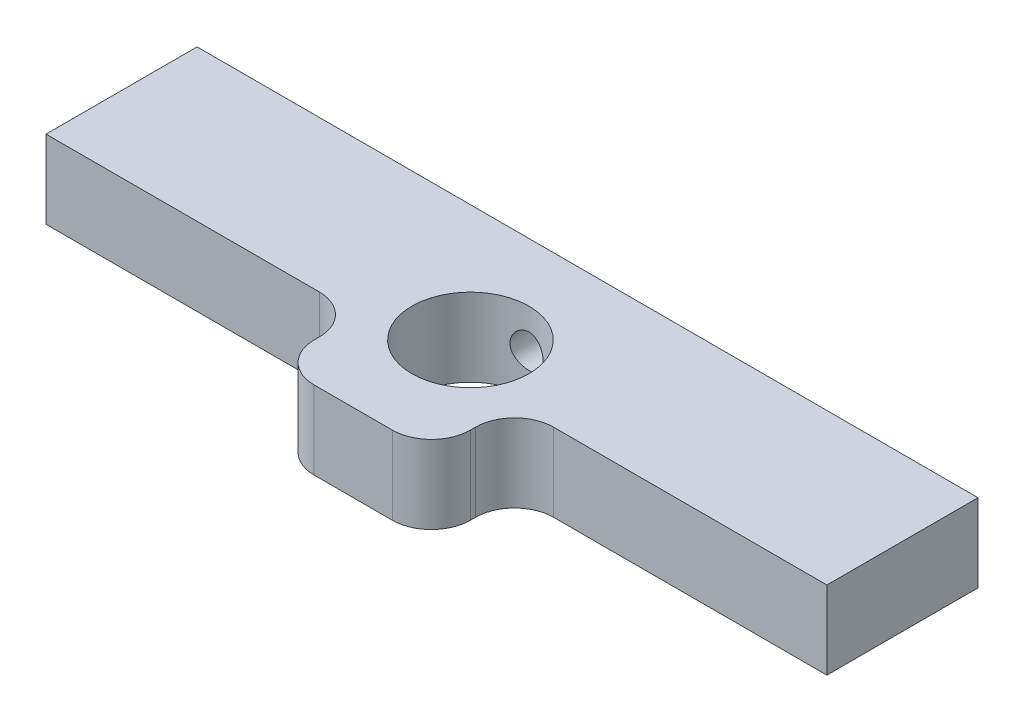
from build123d import *

# Parameters (mm, degrees)
SKETCH1_W                  = 63.5
SKETCH1_H                  = 19.05
SKETCH1_R                  = 4.7625
BOSS_EXTRUDE1_DEPTH        = 6.35
F_6_32_TAPPED_HOLE1_REACH  = 39.567
F_6_32_TAPPED_HOLE1_BORE_R = 1.35255
CUT_EXTRUDE1_REACH         = 35.751
SKETCH5_W                  = 25.4
SKETCH5_H                  = 6.7627246
FILLET1_R                  = 3.175


with BuildPart() as part:
    # Sketch1 → Boss-Extrude1 (new body)
    with BuildSketch(Plane(origin=(0, 0, 0), x_dir=(1, 0, 0), z_dir=(0, 1, 0))):
        Rectangle(SKETCH1_W, SKETCH1_H)
        with Locations(Location((0, 0, 0), (0, 0, 270))):
            Circle(SKETCH1_R, mode=Mode.SUBTRACT)
    extrude(amount=BOSS_EXTRUDE1_DEPTH)

    # #6-32 Tapped Hole1 bore → #6-32 Tapped Hole1 (cut, up to next)
    with BuildSketch(Plane(origin=(0, 0, -9.525), x_dir=(-1, 0, 0), z_dir=(0, 0, -1)), mode=Mode.PRIVATE) as f_6_32_tapped_hole1_sk1:
        with Locations((0, 3.175)):
            Circle(F_6_32_TAPPED_HOLE1_BORE_R)
    f_6_32_tapped_hole1_tool1 = extrude(f_6_32_tapped_hole1_sk1.sketch, amount=-F_6_32_TAPPED_HOLE1_REACH, mode=Mode.PRIVATE) & part.part
    add(f_6_32_tapped_hole1_tool1.solids().sort_by_distance((0, 3.175, -9.525))[0], mode=Mode.SUBTRACT)

    # Sketch5 → Cut-Extrude1 (cut, up to next)
    with BuildSketch(Plane(origin=(0, 6.35, 0), x_dir=(1, 0, 0), z_dir=(0, 1, 0)), mode=Mode.PRIVATE) as cut_extrude1_sk1:
        with Locations((19.05, -6.1436377)):
            Rectangle(SKETCH5_W, SKETCH5_H)
    cut_extrude1_tool1 = extrude(cut_extrude1_sk1.sketch, amount=-CUT_EXTRUDE1_REACH, mode=Mode.PRIVATE) & part.part
    # Sketch5 → Cut-Extrude1 (cut, up to next)
    with BuildSketch(Plane(origin=(0, 6.35, 0), x_dir=(1, 0, 0), z_dir=(0, 1, 0)), mode=Mode.PRIVATE) as cut_extrude1_sk2:
        with Locations((-19.05, -6.1436377)):
            Rectangle(SKETCH5_W, SKETCH5_H)
    cut_extrude1_tool2 = extrude(cut_extrude1_sk2.sketch, amount=-CUT_EXTRUDE1_REACH, mode=Mode.PRIVATE) & part.part
    add(cut_extrude1_tool1.solids().sort_by_distance((19.05, 6.35, 6.143638))[0], mode=Mode.SUBTRACT)
    add(cut_extrude1_tool2.solids().sort_by_distance((-19.05, 6.35, 6.143638))[0], mode=Mode.SUBTRACT)

    # Fillet1
    fillet1_edges = [part.edges().sort_by_distance(p)[0] for p in [
        (-6.35, 3.175, 2.7622754),
        (-6.35, 3.175, 9.525),
        (6.35, 3.175, 9.525),
        (6.35, 3.175, 2.7622754),
    ]]
    fillet(fillet1_edges, radius=FILLET1_R)


solid = part.part
